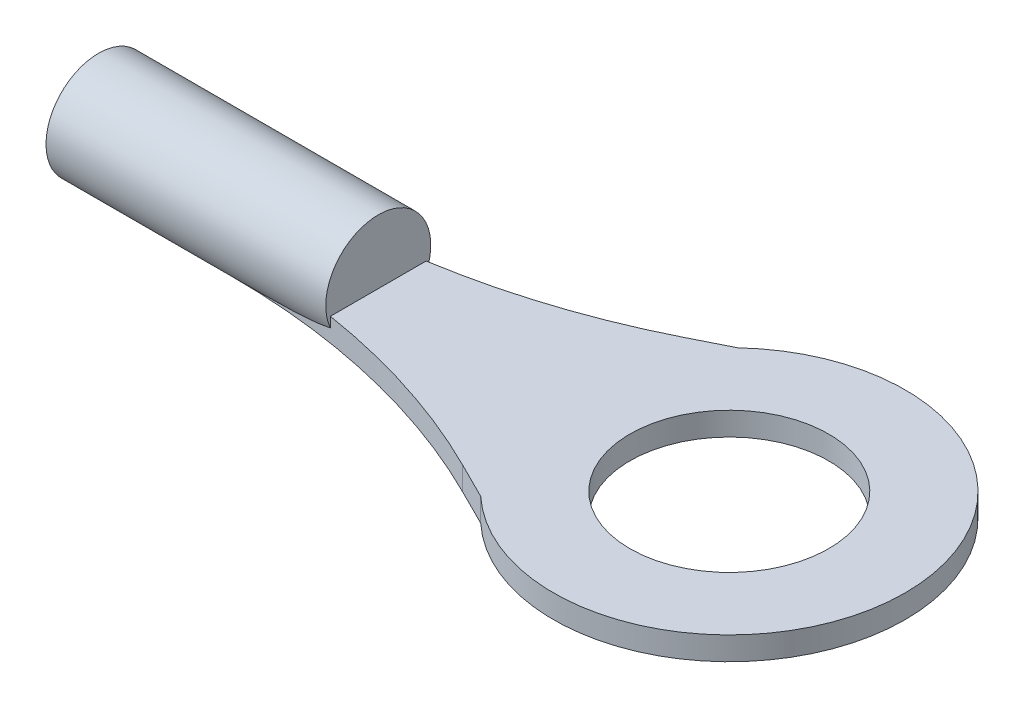
from build123d import *

# Parameters (mm, degrees)
SKETCH1_R           = 3.3655
BOSS_EXTRUDE1_DEPTH = 0.7874
SKETCH2_R           = 1.778
BOSS_EXTRUDE2_DEPTH = 9.4742
SKETCH3_R           = 1.336576357
CUT_EXTRUDE1_DEPTH  = 4.3942


with BuildPart() as part:
    # Sketch1 → Boss-Extrude1 (new body)
    with BuildSketch(Plane(origin=(0, 0, 0), x_dir=(1, 0, 0), z_dir=(0, 1, 0))):
        with BuildLine():
            Line((-21.3614, 0), (-21.3614, 1.3335))
            Line((-21.3614, 1.3335), (-15.503317076, 1.3335))
            ThreePointArc((-15.503317076, 1.3335), (-10.252349187, 1.944748659), (-5.282190317, 3.745806542))
            Line((-5.282190317, 3.745806542), (-4.063378909, 4.355050118))
            ThreePointArc((-4.063378909, 4.355050118), (5.9563, 0), (-4.063378909, -4.355050118))
            Line((-4.063378909, -4.355050118), (-5.282190317, -3.745806542))
            ThreePointArc((-5.282190317, -3.745806542), (-10.252349187, -1.944748659), (-15.503317076, -1.3335))
            Line((-15.503317076, -1.3335), (-21.3614, -1.3335))
            Line((-21.3614, -1.3335), (-21.3614, 0))
        make_face()
        with Locations(Location((0, 0, 0), (0, 0, 270))):
            Circle(SKETCH1_R, mode=Mode.SUBTRACT)
    extrude(amount=BOSS_EXTRUDE1_DEPTH)

    # Sketch2 → Boss-Extrude2 (add)
    with BuildSketch(Plane.ZY.offset(21.3614)):
        with Locations((0, 1.176036458)):
            Circle(SKETCH2_R)
    extrude(amount=-BOSS_EXTRUDE2_DEPTH)

    # Sketch3 → Cut-Extrude1 (cut)
    with BuildSketch(Plane.ZY.offset(21.3614)):
        with Locations((0, 1.176036458)):
            Circle(SKETCH3_R)
    extrude(amount=-CUT_EXTRUDE1_DEPTH, mode=Mode.SUBTRACT)


solid = part.part
